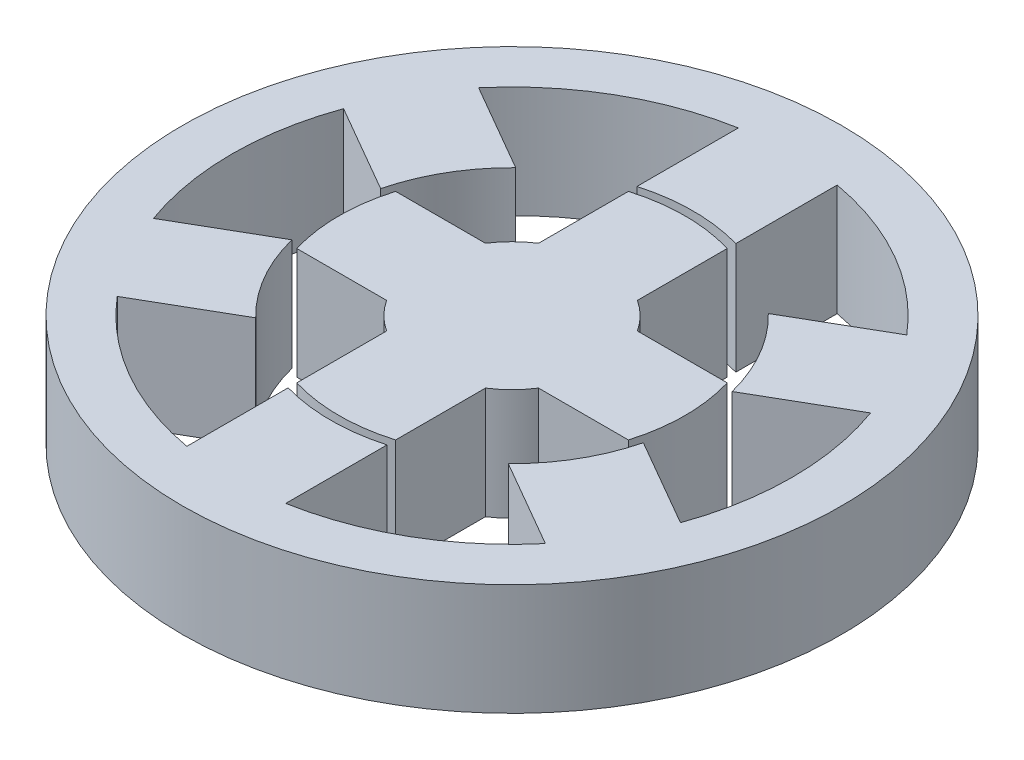
from build123d import *

# Parameters (mm, degrees)
IZIM1_R                     = 10000
Y_KSEKLIK_EKSTR_ZYON4_DEPTH = 3381


with BuildPart() as part:
    # Çizim1 → Yükseklik-Ekstrüzyon4 (new body)
    # profile 1 of 3: a face of its own
    with BuildSketch(Plane(origin=(0, 0, 0), x_dir=(1, 0, 0), z_dir=(0, 1, 0))):
        with Locations(Location((0, 0, 0), (0, 0, 270))):
            Circle(IZIM1_R)
        with BuildLine():
            ThreePointArc((-6495.688373095, -5482.338238347), (-4250, -7361.215932168), (-1500, -8366.600265341))
            Line((-1500, -8366.600265341), (-1500, -5291.502622129))
            ThreePointArc((-1500, -5291.502622129), (0, -5500), (1500, -5291.502622129))
            Line((1500, -5291.502622129), (1500, -8366.600265341))
            ThreePointArc((1500, -8366.600265341), (4250, -7361.215932168), (6495.688373095, -5482.338238347))
            Line((6495.688373095, -5482.338238347), (3832.575694956, -3944.789416741))
            ThreePointArc((3832.575694956, -3944.789416741), (4763.139720814, -2750), (5332.575694956, -1346.713205388))
            Line((5332.575694956, -1346.713205388), (7995.688373095, -2884.262026994))
            ThreePointArc((7995.688373095, -2884.262026994), (8500, 0), (7995.688373095, 2884.262026994))
            Line((7995.688373095, 2884.262026994), (5332.575694956, 1346.713205388))
            ThreePointArc((5332.575694956, 1346.713205388), (4763.139720814, 2750), (3832.575694956, 3944.789416741))
            Line((3832.575694956, 3944.789416741), (6495.688373095, 5482.338238347))
            ThreePointArc((6495.688373095, 5482.338238347), (4250, 7361.215932168), (1500, 8366.600265341))
            Line((1500, 8366.600265341), (1500, 5291.502622129))
            ThreePointArc((1500, 5291.502622129), (0, 5500), (-1500, 5291.502622129))
            Line((-1500, 5291.502622129), (-1500, 8366.600265341))
            ThreePointArc((-1500, 8366.600265341), (-4250, 7361.215932168), (-6495.688373095, 5482.338238347))
            Line((-6495.688373095, 5482.338238347), (-3832.575694956, 3944.789416741))
            ThreePointArc((-3832.575694956, 3944.789416741), (-4763.139720814, 2750), (-5332.575694956, 1346.713205388))
            Line((-5332.575694956, 1346.713205388), (-7995.688373095, 2884.262026994))
            ThreePointArc((-7995.688373095, 2884.262026994), (-8500, 0), (-7995.688373095, -2884.262026994))
            Line((-7995.688373095, -2884.262026994), (-5332.575694956, -1346.713205388))
            ThreePointArc((-5332.575694956, -1346.713205388), (-4763.139720814, -2750), (-3832.575694956, -3944.789416741))
            Line((-3832.575694956, -3944.789416741), (-6495.688373095, -5482.338238347))
        make_face(mode=Mode.SUBTRACT)
    # profile 2 of 3: a face of its own
    with BuildSketch(Plane(origin=(0, 0, 0), x_dir=(1, 0, 0), z_dir=(0, 1, 0))):
        with BuildLine():
            Line((1500, -2304.886114323), (-1500, -2304.886114323))
            ThreePointArc((-1500, -2304.886114323), (-1944.543648263, -1944.543648263), (-2304.886114323, -1500))
            Line((-2304.886114323, -1500), (-5031.152949375, -1500))
            ThreePointArc((-5031.152949375, -1500), (-5250, 0), (-5031.152949375, 1500))
            Line((-5031.152949375, 1500), (-2304.886114323, 1500))
            ThreePointArc((-2304.886114323, 1500), (-1944.543648263, 1944.543648263), (-1500, 2304.886114323))
            Line((-1500, 2304.886114323), (-1500, 5031.152949375))
            ThreePointArc((-1500, 5031.152949375), (0, 5250), (1500, 5031.152949375))
            Line((1500, 5031.152949375), (1500, 2304.886114323))
            ThreePointArc((1500, 2304.886114323), (1944.543648263, 1944.543648263), (2304.886114323, 1500))
            Line((2304.886114323, 1500), (5031.152949375, 1500))
            ThreePointArc((5031.152949375, 1500), (5250, 0), (5031.152949375, -1500))
            Line((5031.152949375, -1500), (2304.886114323, -1500))
            ThreePointArc((2304.886114323, -1500), (1944.543648263, -1944.543648263), (1500, -2304.886114323))
        make_face()
    # profile 3 of 3: a face of its own
    with BuildSketch(Plane(origin=(0, 0, 0), x_dir=(1, 0, 0), z_dir=(0, 1, 0))):
        with BuildLine():
            Line((-1500, -5031.152949375), (-1500, -2304.886114323))
            Line((-1500, -2304.886114323), (1500, -2304.886114323))
            Line((1500, -2304.886114323), (1500, -5031.152949375))
            ThreePointArc((1500, -5031.152949375), (0, -5250), (-1500, -5031.152949375))
        make_face()
    extrude(amount=Y_KSEKLIK_EKSTR_ZYON4_DEPTH)


solid = part.part
